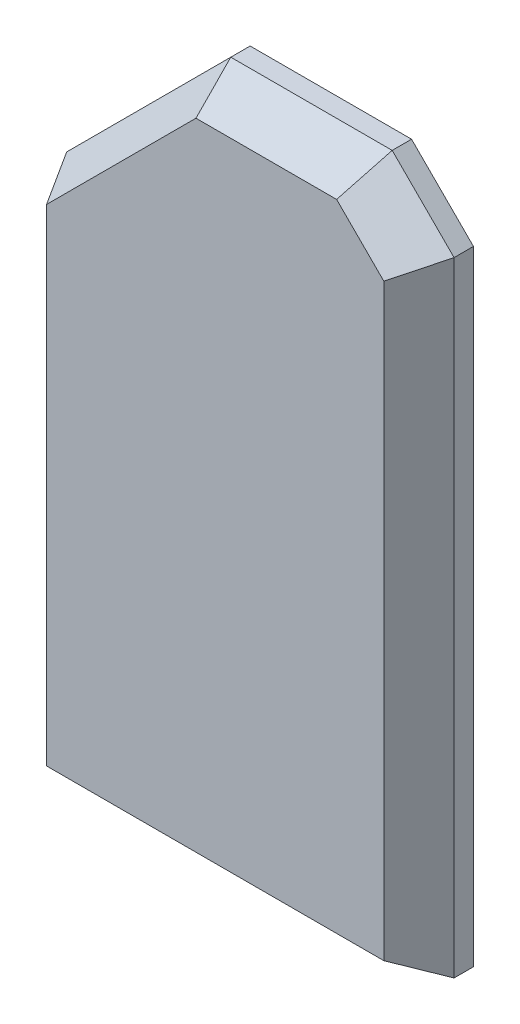
from build123d import *

# Parameters (mm, degrees)
BOSS_EXTRUDE1_DEPTH           = 7
BOSS_EXTRUDE1_TAPER           = 29
BOSS_EXTRUDE1_OTHER_WAY_DEPTH = 3
SKETCH2_R                     = 1.5
CUT_EXTRUDE1_DEPTH            = 3


with BuildPart() as part:
    # Sketch1 → Boss-Extrude1 (new body)
    with BuildSketch(Plane.XY):
        Polygon((-57.811201834, -26.002477708), (2.188798166, -26.002477708), (2.188798166, 70.629617347), (-7.398088721, 80.216504233), (-32.398088721, 80.216504233), (-57.811201834, 54.80339112), align=None)
    extrude(amount=BOSS_EXTRUDE1_DEPTH, taper=BOSS_EXTRUDE1_TAPER)

    # Sketch1 → Boss-Extrude1 other way (add)
    with BuildSketch(Plane.XY):
        Polygon((-57.811201834, -26.002477708), (2.188798166, -26.002477708), (2.188798166, 70.629617347), (-7.398088721, 80.216504233), (-32.398088721, 80.216504233), (-57.811201834, 54.80339112), align=None)
    extrude(amount=-BOSS_EXTRUDE1_OTHER_WAY_DEPTH)

    # Sketch2 → Cut-Extrude1 (cut)
    with BuildSketch(Plane(origin=(0, 0, -3), x_dir=(-1, 0, 0), z_dir=(0, 0, -1))):
        with Locations((19.898088721, 56.224723903)):
            Circle(SKETCH2_R)
    extrude(amount=-CUT_EXTRUDE1_DEPTH, mode=Mode.SUBTRACT)


solid = part.part
